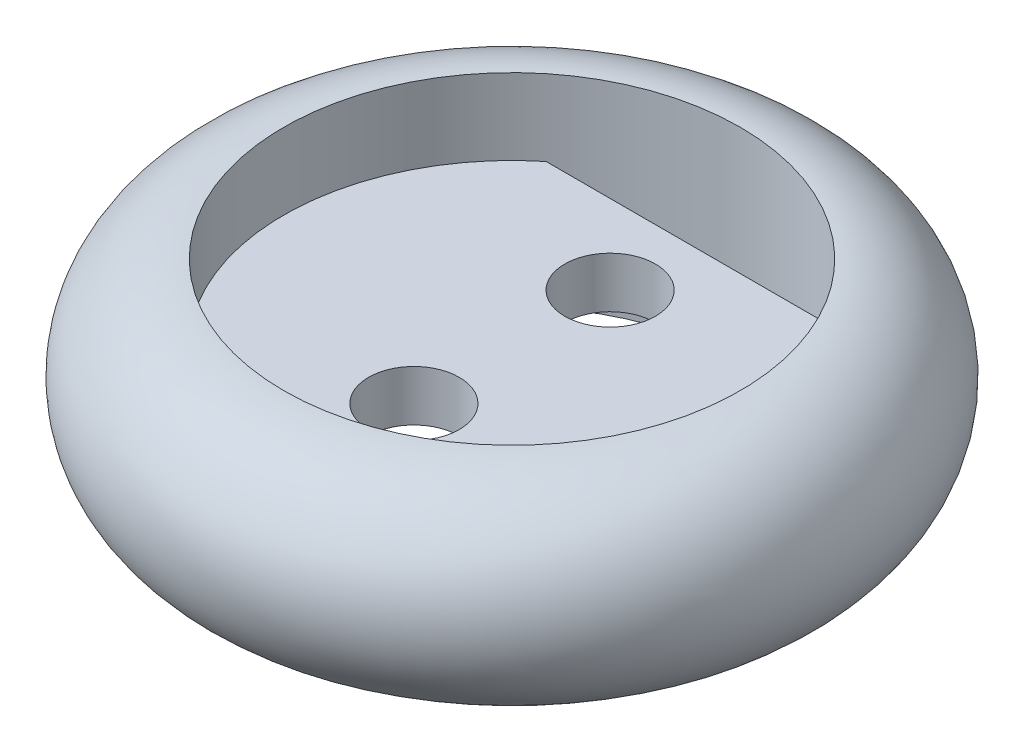
from build123d import *

# Parameters (mm, degrees)
SKETCH_1_W          = 90
SKETCH_1_H          = 70
EXTRUDE_1_DEPTH     = 10
FILLET_1_R          = 10
SKETCH_2_R          = 8.935644791
CUT_EXTRUDE_1_DEPTH = 10


with BuildPart() as part:
    # 草图1 → 凸台-拉伸1 (new body)
    with BuildSketch(Plane(origin=(0, 0, 0), x_dir=(1, 0, 0), z_dir=(0, 1, 0))):
        Rectangle(SKETCH_1_W, SKETCH_1_H)
    extrude(amount=EXTRUDE_1_DEPTH)

    # 圆角1
    fillet_1_edges = [part.edges().sort_by_distance(p)[0] for p in [
        (45, 5, 35),
        (-45, 5, 35),
        (-45, 5, -35),
        (45, 5, -35),
    ]]
    fillet(fillet_1_edges, radius=FILLET_1_R)

    # 草图2 → 切除-拉伸1 (cut)
    with BuildSketch(Plane(origin=(0, 10, 0), x_dir=(1, 0, 0), z_dir=(0, 1, 0))):
        with Locations(Location((0, 19.345170793, 0), (0, 0, 270))):
            Circle(SKETCH_2_R)
        with Locations(Location((0, -19.345170793, 0), (0, 0, 90))):
            Circle(SKETCH_2_R)
    extrude(amount=-CUT_EXTRUDE_1_DEPTH, mode=Mode.SUBTRACT)

    # 草图5 → 旋转1 (revolve)
    with BuildSketch(Plane.XY, mode=Mode.PRIVATE) as revolve_1_sk:
        with BuildLine():
            Line((45, 25), (45, -15))
            ThreePointArc((45, -15), (65, 5), (45, 25))
        make_face()
    revolve(revolve_1_sk.sketch.rotate(Axis((0, 30.833762992, 0), (0, -1, 0)), 90), axis=Axis((0, 30.833762992, 0), (0, -1, 0)))


solid = part.part
